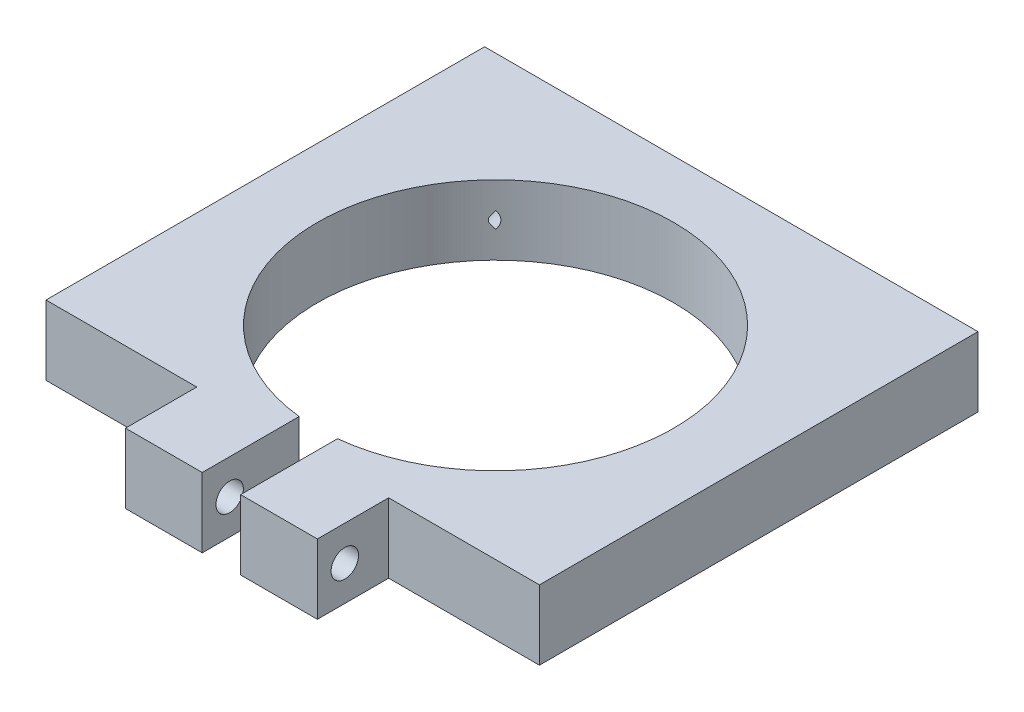
from build123d import *

# Parameters (mm, degrees)
ESBO_O1_W                          = 90
ESBO_O1_H                          = 93
RESSALTO_EXTRUS_O1_DEPTH           = 12.7
ESBO_O3_R                          = 32.51
CORTE_EXTRUS_O2_DEPTH              = 66.943460631
CORTE_EXTRUS_O4_REACH              = 67.943
ESBO_O5_W                          = 27.5
ESBO_O5_H                          = 13
CORTE_EXTRUS_O5_REACH              = 67.943
ESBO_O6_W                          = 7
ESBO_O6_H                          = 26.329700269
CORTE_EXTRUS_O6_REACH              = 80.929
ESBO_O7_R                          = 2.5
TALADRO_DE_MARGEN_PARA_00001_D     = 5
TALADRO_DE_MARGEN_PARA_00001_DEPTH = 20
TALADRO_DE_MARGEN_PARA_00001_TIP   = 1.502151548


with BuildPart() as part:
    # Esboço1 → Ressalto-extrusão1 (new body)
    with BuildSketch(Plane(origin=(0, 0, 0), x_dir=(1, 0, 0), z_dir=(0, 1, 0))):
        Rectangle(ESBO_O1_W, ESBO_O1_H)
    extrude(amount=RESSALTO_EXTRUS_O1_DEPTH)

    # Esboço3 → Corte-extrusão2 (cut, through all)
    with BuildSketch(Plane(origin=(0, 12.7, 0), x_dir=(1, 0, 0), z_dir=(0, 1, 0))):
        with Locations(Location((0, 3.5, 0), (0, 0, 270))):
            Circle(ESBO_O3_R)
    extrude(amount=-CORTE_EXTRUS_O2_DEPTH, mode=Mode.SUBTRACT)

    # Esboço5 → Corte-extrusão4 (cut, up to next)
    with BuildSketch(Plane(origin=(0, 12.7, 0), x_dir=(1, 0, 0), z_dir=(0, 1, 0)), mode=Mode.PRIVATE) as corte_extrus_o4_sk1:
        with Locations((31.25, -40)):
            Rectangle(ESBO_O5_W, ESBO_O5_H)
    corte_extrus_o4_tool1 = extrude(corte_extrus_o4_sk1.sketch, amount=-CORTE_EXTRUS_O4_REACH, mode=Mode.PRIVATE) & part.part
    # Esboço5 → Corte-extrusão4 (cut, up to next)
    with BuildSketch(Plane(origin=(0, 12.7, 0), x_dir=(1, 0, 0), z_dir=(0, 1, 0)), mode=Mode.PRIVATE) as corte_extrus_o4_sk2:
        with Locations((-31.25, -40)):
            Rectangle(ESBO_O5_W, ESBO_O5_H)
    corte_extrus_o4_tool2 = extrude(corte_extrus_o4_sk2.sketch, amount=-CORTE_EXTRUS_O4_REACH, mode=Mode.PRIVATE) & part.part
    add(corte_extrus_o4_tool1.solids().sort_by_distance((31.25, 12.7, 40))[0], mode=Mode.SUBTRACT)
    add(corte_extrus_o4_tool2.solids().sort_by_distance((-31.25, 12.7, 40))[0], mode=Mode.SUBTRACT)

    # Esboço6 → Corte-extrusão5 (cut, up to next)
    with BuildSketch(Plane(origin=(0, 12.7, 0), x_dir=(1, 0, 0), z_dir=(0, 1, 0)), mode=Mode.PRIVATE) as corte_extrus_o5_sk1:
        with Locations((0, -33.335149866)):
            Rectangle(ESBO_O6_W, ESBO_O6_H)
    corte_extrus_o5_tool1 = extrude(corte_extrus_o5_sk1.sketch, amount=-CORTE_EXTRUS_O5_REACH, mode=Mode.PRIVATE) & part.part
    add(corte_extrus_o5_tool1.solids().sort_by_distance((0, 12.7, 33.33515))[0], mode=Mode.SUBTRACT)

    # Corte-extrusão6: up to this face of the body (flat: up to its plane)
    corte_extrus_o6_end = Plane(part.part.faces().sort_by_distance((17.5, 6.35, 40))[0])
    # Esboço7 → Corte-extrusão6 (cut, up to the picked face)
    with BuildSketch(Plane.ZY.offset(17.5), mode=Mode.PRIVATE) as corte_extrus_o6_sk1:
        with Locations((41.5, 6.35)):
            Circle(ESBO_O7_R)
    corte_extrus_o6_tool1 = split(extrude(corte_extrus_o6_sk1.sketch, amount=-CORTE_EXTRUS_O6_REACH, mode=Mode.PRIVATE), bisect_by=corte_extrus_o6_end, keep=Keep.BOTH, mode=Mode.PRIVATE)
    add(corte_extrus_o6_tool1.solids().sort_by(Axis((-17.5, 6.35, 41.5), (1, 0, 0)))[0], mode=Mode.SUBTRACT)

    # Taladro de margen para #00001
    with Locations(Plane(origin=(0, 0, -46.5), x_dir=(-1, 0, 0), z_dir=(0, 0, -1))):
        with Locations((-40, 6.35), (-25, 6.35), (40, 6.35), (25, 6.35)):
            Hole(TALADRO_DE_MARGEN_PARA_00001_D / 2, depth=TALADRO_DE_MARGEN_PARA_00001_DEPTH)
            with Locations((0, 0, -(TALADRO_DE_MARGEN_PARA_00001_DEPTH + TALADRO_DE_MARGEN_PARA_00001_TIP / 2))):  # 118° drill point
                Cone(0, TALADRO_DE_MARGEN_PARA_00001_D / 2, TALADRO_DE_MARGEN_PARA_00001_TIP, mode=Mode.SUBTRACT)


solid = part.part
